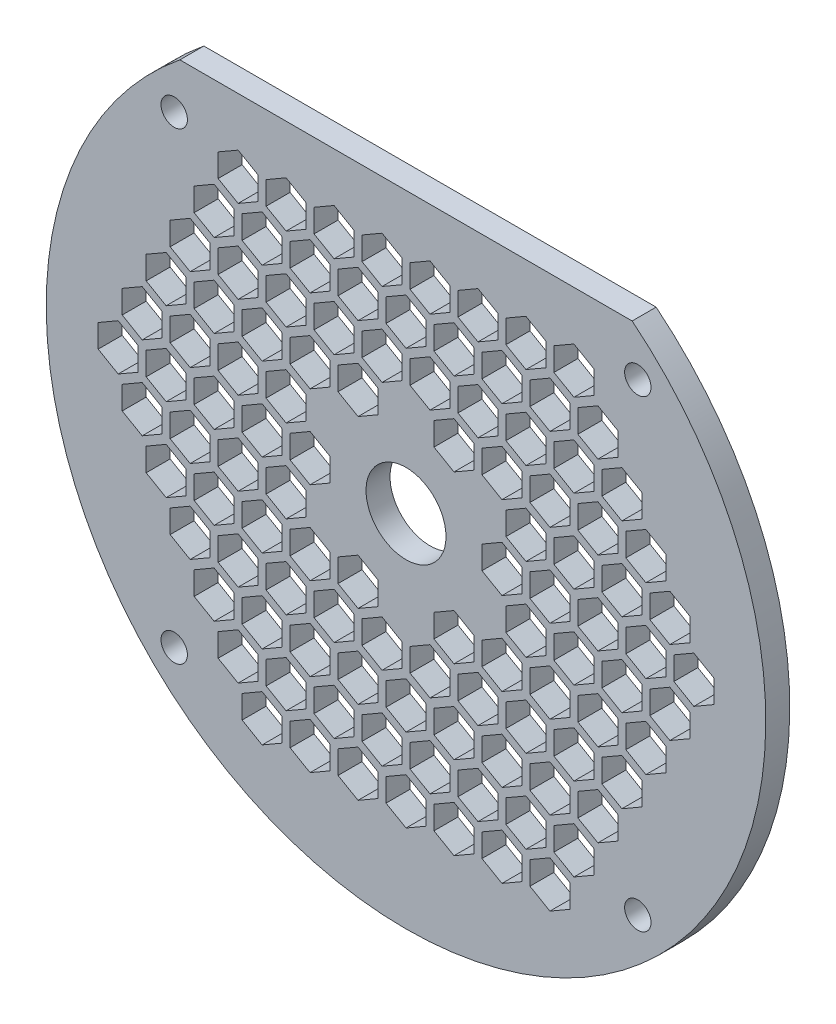
from build123d import *

# Parameters (mm, degrees)
SKETCH_1_R          = 90
EXTRUDE_1_DEPTH     = 6
SKETCH_3_R          = 10
CUT_EXTRUDE_2_DEPTH = 128.42056349
SKETCH_4_R          = 3.3
CUT_EXTRUDE_3_DEPTH = 128.42056349
SKETCH_5_W          = 220
SKETCH_5_H          = 40
CUT_EXTRUDE_4_DEPTH = 128.42056349
CUT_EXTRUDE_5_DEPTH = 128.42056349
CUT_EXTRUDE_7_DEPTH = 128.42056349
CUT_EXTRUDE_8_DEPTH = 128.42056349
CUT_EXTRUDE_9_DEPTH = 128.42056349


with BuildPart() as part:
    # 草图1 → 凸台-拉伸1 (new body)
    with BuildSketch(Plane.XY):
        Circle(SKETCH_1_R)
    extrude(amount=EXTRUDE_1_DEPTH)

    # 草图3 → 切除-拉伸2 (cut, through all)
    with BuildSketch(Plane.XY):
        Circle(SKETCH_3_R)
    extrude(amount=CUT_EXTRUDE_2_DEPTH, mode=Mode.SUBTRACT)

    # 草图4 → 切除-拉伸3 (cut, through all)
    with BuildSketch(Plane.XY):
        with Locations((57.982756, 57.982756)):
            Circle(SKETCH_4_R)
        with Locations((-57.982756, 57.982756)):
            Circle(SKETCH_4_R)
        with Locations((-57.982756, -57.982756)):
            Circle(SKETCH_4_R)
        with Locations((57.982756, -57.982756)):
            Circle(SKETCH_4_R)
    extrude(amount=CUT_EXTRUDE_3_DEPTH, mode=Mode.SUBTRACT)

    # 草图5 → 切除-拉伸4 (cut, through all)
    with BuildSketch(Plane.XY):
        with Locations((0, 90)):
            Rectangle(SKETCH_5_W, SKETCH_5_H)
    extrude(amount=CUT_EXTRUDE_4_DEPTH, mode=Mode.SUBTRACT)

    # 草图6 → 切除-拉伸5 (cut, through all)
    with BuildSketch(Plane.XY):
        Polygon((0, -56.5785), (5, -59.4653), (5, -65.2388), (0, -68.1255), (-5, -65.2388), (-5, -59.4653), align=None)
        Polygon((12, -56.5785), (17, -59.4653), (17, -65.2388), (12, -68.1255), (7, -65.2388), (7, -59.4653), align=None)
        Polygon((-12, -56.5785), (-7, -59.4653), (-7, -65.2388), (-12, -68.1255), (-17, -65.2388), (-17, -59.4653), align=None)
        Polygon((24, -56.5785), (29, -59.4653), (29, -65.2388), (24, -68.1255), (19, -65.2388), (19, -59.4653), align=None)
        Polygon((-24, -56.5785), (-19, -59.4653), (-19, -65.2388), (-24, -68.1255), (-29, -65.2388), (-29, -59.4653), align=None)
        Polygon((36, -56.5785), (41, -59.4653), (41, -65.2388), (36, -68.1255), (31, -65.2388), (31, -59.4653), align=None)
        Polygon((-36, -56.5785), (-31, -59.4653), (-31, -65.2388), (-36, -68.1255), (-41, -65.2388), (-41, -59.4653), align=None)
        Polygon((6, -46.1865), (11, -49.0733), (11, -54.8468), (6, -57.7335), (1, -54.8468), (1, -49.0733), align=None)
        Polygon((-6, -46.1865), (-1, -49.0733), (-1, -54.8468), (-6, -57.7335), (-11, -54.8468), (-11, -49.0733), align=None)
        Polygon((18, -46.1865), (23, -49.0733), (23, -54.8468), (18, -57.7335), (13, -54.8468), (13, -49.0733), align=None)
        Polygon((-18, -46.1865), (-13, -49.0733), (-13, -54.8468), (-18, -57.7335), (-23, -54.8468), (-23, -49.0733), align=None)
        Polygon((30, -46.1865), (35, -49.0733), (35, -54.8468), (30, -57.7335), (25, -54.8468), (25, -49.0733), align=None)
        Polygon((-30, -46.1865), (-25, -49.0733), (-25, -54.8468), (-30, -57.7335), (-35, -54.8468), (-35, -49.0733), align=None)
        Polygon((42, -46.1865), (47, -49.0733), (47, -54.8468), (42, -57.7335), (37, -54.8468), (37, -49.0733), align=None)
        Polygon((-42, -46.1865), (-37, -49.0733), (-37, -54.8468), (-42, -57.7335), (-47, -54.8468), (-47, -49.0733), align=None)
        Polygon((0, -35.7945), (5, -38.6813), (5, -44.4548), (0, -47.3415), (-5, -44.4548), (-5, -38.6813), align=None)
        Polygon((12, -35.7945), (17, -38.6813), (17, -44.4548), (12, -47.3415), (7, -44.4548), (7, -38.6813), align=None)
        Polygon((-12, -35.7945), (-7, -38.6813), (-7, -44.4548), (-12, -47.3415), (-17, -44.4548), (-17, -38.6813), align=None)
        Polygon((24, -35.7945), (29, -38.6813), (29, -44.4548), (24, -47.3415), (19, -44.4548), (19, -38.6813), align=None)
        Polygon((-24, -35.7945), (-19, -38.6813), (-19, -44.4548), (-24, -47.3415), (-29, -44.4548), (-29, -38.6813), align=None)
        Polygon((36, -35.7945), (41, -38.6813), (41, -44.4548), (36, -47.3415), (31, -44.4548), (31, -38.6813), align=None)
        Polygon((-36, -35.7945), (-31, -38.6813), (-31, -44.4548), (-36, -47.3415), (-41, -44.4548), (-41, -38.6813), align=None)
        Polygon((48, -35.7945), (53, -38.6813), (53, -44.4548), (48, -47.3415), (43, -44.4548), (43, -38.6813), align=None)
        Polygon((-48, -35.7945), (-43, -38.6813), (-43, -44.4548), (-48, -47.3415), (-53, -44.4548), (-53, -38.6813), align=None)
    extrude(amount=CUT_EXTRUDE_5_DEPTH, mode=Mode.SUBTRACT)

    # 草图8 → 切除-拉伸7 (cut, through all)
    with BuildSketch(Plane.XY):
        Polygon((6, -25.4025), (11, -28.2893), (11, -34.0628), (6, -36.9495), (1, -34.0628), (1, -28.2893), align=None)
        Polygon((-6, -25.4025), (-1, -28.2893), (-1, -34.0628), (-6, -36.9495), (-11, -34.0628), (-11, -28.2893), align=None)
        Polygon((18, -25.4025), (23, -28.2893), (23, -34.0628), (18, -36.9495), (13, -34.0628), (13, -28.2893), align=None)
        Polygon((-18, -25.4025), (-13, -28.2893), (-13, -34.0628), (-18, -36.9495), (-23, -34.0628), (-23, -28.2893), align=None)
        Polygon((30, -25.4025), (35, -28.2893), (35, -34.0628), (30, -36.9495), (25, -34.0628), (25, -28.2893), align=None)
        Polygon((-30, -25.4025), (-25, -28.2893), (-25, -34.0628), (-30, -36.9495), (-35, -34.0628), (-35, -28.2893), align=None)
        Polygon((42, -25.4025), (47, -28.2893), (47, -34.0628), (42, -36.9495), (37, -34.0628), (37, -28.2893), align=None)
        Polygon((-42, -25.4025), (-37, -28.2893), (-37, -34.0628), (-42, -36.9495), (-47, -34.0628), (-47, -28.2893), align=None)
        Polygon((54, -25.4025), (59, -28.2893), (59, -34.0628), (54, -36.9495), (49, -34.0628), (49, -28.2893), align=None)
        Polygon((-54, -25.4025), (-49, -28.2893), (-49, -34.0628), (-54, -36.9495), (-59, -34.0628), (-59, -28.2893), align=None)
        Polygon((12, -15.0105), (17, -17.8973), (17, -23.6708), (12, -26.5575), (7, -23.6708), (7, -17.8973), align=None)
        Polygon((-12, -15.0105), (-7, -17.8973), (-7, -23.6708), (-12, -26.5575), (-17, -23.6708), (-17, -17.8973), align=None)
        Polygon((24, -15.0105), (29, -17.8973), (29, -23.6708), (24, -26.5575), (19, -23.6708), (19, -17.8973), align=None)
        Polygon((-24, -15.0105), (-19, -17.8973), (-19, -23.6708), (-24, -26.5575), (-29, -23.6708), (-29, -17.8973), align=None)
        Polygon((36, -15.0105), (41, -17.8973), (41, -23.6708), (36, -26.5575), (31, -23.6708), (31, -17.8973), align=None)
        Polygon((-36, -15.0105), (-31, -17.8973), (-31, -23.6708), (-36, -26.5575), (-41, -23.6708), (-41, -17.8973), align=None)
        Polygon((48, -15.0105), (53, -17.8973), (53, -23.6708), (48, -26.5575), (43, -23.6708), (43, -17.8973), align=None)
        Polygon((-48, -15.0105), (-43, -17.8973), (-43, -23.6708), (-48, -26.5575), (-53, -23.6708), (-53, -17.8973), align=None)
        Polygon((60, -15.0105), (65, -17.8973), (65, -23.6708), (60, -26.5575), (55, -23.6708), (55, -17.8973), align=None)
        Polygon((-60, -15.0105), (-55, -17.8973), (-55, -23.6708), (-60, -26.5575), (-65, -23.6708), (-65, -17.8973), align=None)
        Polygon((30, -4.6185), (35, -7.5053), (35, -13.2788), (30, -16.1655), (25, -13.2788), (25, -7.5053), align=None)
        Polygon((-30, -4.6185), (-25, -7.5053), (-25, -13.2788), (-30, -16.1655), (-35, -13.2788), (-35, -7.5053), align=None)
        Polygon((42, -4.6185), (47, -7.5053), (47, -13.2788), (42, -16.1655), (37, -13.2788), (37, -7.5053), align=None)
        Polygon((-42, -4.6185), (-37, -7.5053), (-37, -13.2788), (-42, -16.1655), (-47, -13.2788), (-47, -7.5053), align=None)
        Polygon((54, -4.6185), (59, -7.5053), (59, -13.2788), (54, -16.1655), (49, -13.2788), (49, -7.5053), align=None)
        Polygon((-54, -4.6185), (-49, -7.5053), (-49, -13.2788), (-54, -16.1655), (-59, -13.2788), (-59, -7.5053), align=None)
        Polygon((66, -4.6185), (71, -7.5053), (71, -13.2788), (66, -16.1655), (61, -13.2788), (61, -7.5053), align=None)
        Polygon((-66, -4.6185), (-61, -7.5053), (-61, -13.2788), (-66, -16.1655), (-71, -13.2788), (-71, -7.5053), align=None)
    extrude(amount=CUT_EXTRUDE_7_DEPTH, mode=Mode.SUBTRACT)

    # 草图9 → 切除-拉伸8 (cut, through all)
    with BuildSketch(Plane.XY):
        Polygon((24, 5.7735), (29, 2.8868), (29, -2.8868), (24, -5.7735), (19, -2.8868), (19, 2.8868), align=None)
        Polygon((-24, 5.7735), (-19, 2.8868), (-19, -2.8868), (-24, -5.7735), (-29, -2.8868), (-29, 2.8868), align=None)
        Polygon((36, 5.7735), (41, 2.8868), (41, -2.8868), (36, -5.7735), (31, -2.8868), (31, 2.8868), align=None)
        Polygon((-36, 5.7735), (-31, 2.8868), (-31, -2.8868), (-36, -5.7735), (-41, -2.8868), (-41, 2.8868), align=None)
        Polygon((48, 5.7735), (53, 2.8868), (53, -2.8868), (48, -5.7735), (43, -2.8868), (43, 2.8868), align=None)
        Polygon((-48, 5.7735), (-43, 2.8868), (-43, -2.8868), (-48, -5.7735), (-53, -2.8868), (-53, 2.8868), align=None)
        Polygon((60, 5.7735), (65, 2.8868), (65, -2.8868), (60, -5.7735), (55, -2.8868), (55, 2.8868), align=None)
        Polygon((-60, 5.7735), (-55, 2.8868), (-55, -2.8868), (-60, -5.7735), (-65, -2.8868), (-65, 2.8868), align=None)
        Polygon((72, 5.7735), (77, 2.8868), (77, -2.8868), (72, -5.7735), (67, -2.8868), (67, 2.8868), align=None)
        Polygon((-72, 5.7735), (-67, 2.8868), (-67, -2.8868), (-72, -5.7735), (-77, -2.8868), (-77, 2.8868), align=None)
        Polygon((30, 16.1655), (35, 13.2788), (35, 7.5053), (30, 4.6185), (25, 7.5053), (25, 13.2788), align=None)
        Polygon((-30, 16.1655), (-25, 13.2788), (-25, 7.5053), (-30, 4.6185), (-35, 7.5053), (-35, 13.2788), align=None)
        Polygon((42, 16.1655), (47, 13.2788), (47, 7.5053), (42, 4.6185), (37, 7.5053), (37, 13.2788), align=None)
        Polygon((-42, 16.1655), (-37, 13.2788), (-37, 7.5053), (-42, 4.6185), (-47, 7.5053), (-47, 13.2788), align=None)
        Polygon((54, 16.1655), (59, 13.2788), (59, 7.5053), (54, 4.6185), (49, 7.5053), (49, 13.2788), align=None)
        Polygon((-54, 16.1655), (-49, 13.2788), (-49, 7.5053), (-54, 4.6185), (-59, 7.5053), (-59, 13.2788), align=None)
        Polygon((66, 16.1655), (71, 13.2788), (71, 7.5053), (66, 4.6185), (61, 7.5053), (61, 13.2788), align=None)
        Polygon((-66, 16.1655), (-61, 13.2788), (-61, 7.5053), (-66, 4.6185), (-71, 7.5053), (-71, 13.2788), align=None)
        Polygon((12, 26.5575), (17, 23.6708), (17, 17.8973), (12, 15.0105), (7, 17.8973), (7, 23.6708), align=None)
        Polygon((-12, 26.5575), (-7, 23.6708), (-7, 17.8973), (-12, 15.0105), (-17, 17.8973), (-17, 23.6708), align=None)
        Polygon((24, 26.5575), (29, 23.6708), (29, 17.8973), (24, 15.0105), (19, 17.8973), (19, 23.6708), align=None)
        Polygon((-24, 26.5575), (-19, 23.6708), (-19, 17.8973), (-24, 15.0105), (-29, 17.8973), (-29, 23.6708), align=None)
        Polygon((36, 26.5575), (41, 23.6708), (41, 17.8973), (36, 15.0105), (31, 17.8973), (31, 23.6708), align=None)
        Polygon((-36, 26.5575), (-31, 23.6708), (-31, 17.8973), (-36, 15.0105), (-41, 17.8973), (-41, 23.6708), align=None)
        Polygon((48, 26.5575), (53, 23.6708), (53, 17.8973), (48, 15.0105), (43, 17.8973), (43, 23.6708), align=None)
        Polygon((-48, 26.5575), (-43, 23.6708), (-43, 17.8973), (-48, 15.0105), (-53, 17.8973), (-53, 23.6708), align=None)
        Polygon((60, 26.5575), (65, 23.6708), (65, 17.8973), (60, 15.0105), (55, 17.8973), (55, 23.6708), align=None)
        Polygon((-60, 26.5575), (-55, 23.6708), (-55, 17.8973), (-60, 15.0105), (-65, 17.8973), (-65, 23.6708), align=None)
    extrude(amount=CUT_EXTRUDE_8_DEPTH, mode=Mode.SUBTRACT)

    # 草图10 → 切除-拉伸9 (cut, through all)
    with BuildSketch(Plane.XY):
        Polygon((6, 36.9495), (11, 34.0628), (11, 28.2893), (6, 25.4025), (1, 28.2893), (1, 34.0628), align=None)
        Polygon((-6, 36.9495), (-1, 34.0628), (-1, 28.2893), (-6, 25.4025), (-11, 28.2893), (-11, 34.0628), align=None)
        Polygon((18, 36.9495), (23, 34.0628), (23, 28.2893), (18, 25.4025), (13, 28.2893), (13, 34.0628), align=None)
        Polygon((-18, 36.9495), (-13, 34.0628), (-13, 28.2893), (-18, 25.4025), (-23, 28.2893), (-23, 34.0628), align=None)
        Polygon((30, 36.9495), (35, 34.0628), (35, 28.2893), (30, 25.4025), (25, 28.2893), (25, 34.0628), align=None)
        Polygon((-30, 36.9495), (-25, 34.0628), (-25, 28.2893), (-30, 25.4025), (-35, 28.2893), (-35, 34.0628), align=None)
        Polygon((42, 36.9495), (47, 34.0628), (47, 28.2893), (42, 25.4025), (37, 28.2893), (37, 34.0628), align=None)
        Polygon((-42, 36.9495), (-37, 34.0628), (-37, 28.2893), (-42, 25.4025), (-47, 28.2893), (-47, 34.0628), align=None)
        Polygon((54, 36.9495), (59, 34.0628), (59, 28.2893), (54, 25.4025), (49, 28.2893), (49, 34.0628), align=None)
        Polygon((-54, 36.9495), (-49, 34.0628), (-49, 28.2893), (-54, 25.4025), (-59, 28.2893), (-59, 34.0628), align=None)
        Polygon((0, 47.3415), (5, 44.4548), (5, 38.6813), (0, 35.7945), (-5, 38.6813), (-5, 44.4548), align=None)
        Polygon((12, 47.3415), (17, 44.4548), (17, 38.6813), (12, 35.7945), (7, 38.6813), (7, 44.4548), align=None)
        Polygon((-12, 47.3415), (-7, 44.4548), (-7, 38.6813), (-12, 35.7945), (-17, 38.6813), (-17, 44.4548), align=None)
        Polygon((24, 47.3415), (29, 44.4548), (29, 38.6813), (24, 35.7945), (19, 38.6813), (19, 44.4548), align=None)
        Polygon((-24, 47.3415), (-19, 44.4548), (-19, 38.6813), (-24, 35.7945), (-29, 38.6813), (-29, 44.4548), align=None)
        Polygon((36, 47.3415), (41, 44.4548), (41, 38.6813), (36, 35.7945), (31, 38.6813), (31, 44.4548), align=None)
        Polygon((-36, 47.3415), (-31, 44.4548), (-31, 38.6813), (-36, 35.7945), (-41, 38.6813), (-41, 44.4548), align=None)
        Polygon((48, 47.3415), (53, 44.4548), (53, 38.6813), (48, 35.7945), (43, 38.6813), (43, 44.4548), align=None)
        Polygon((-48, 47.3415), (-43, 44.4548), (-43, 38.6813), (-48, 35.7945), (-53, 38.6813), (-53, 44.4548), align=None)
        Polygon((6, 57.7335), (11, 54.8468), (11, 49.0733), (6, 46.1865), (1, 49.0733), (1, 54.8468), align=None)
        Polygon((-6, 57.7335), (-1, 54.8468), (-1, 49.0733), (-6, 46.1865), (-11, 49.0733), (-11, 54.8468), align=None)
        Polygon((18, 57.7335), (23, 54.8468), (23, 49.0733), (18, 46.1865), (13, 49.0733), (13, 54.8468), align=None)
        Polygon((-18, 57.7335), (-13, 54.8468), (-13, 49.0733), (-18, 46.1865), (-23, 49.0733), (-23, 54.8468), align=None)
        Polygon((30, 57.7335), (35, 54.8468), (35, 49.0733), (30, 46.1865), (25, 49.0733), (25, 54.8468), align=None)
        Polygon((-30, 57.7335), (-25, 54.8468), (-25, 49.0733), (-30, 46.1865), (-35, 49.0733), (-35, 54.8468), align=None)
        Polygon((42, 57.7335), (47, 54.8468), (47, 49.0733), (42, 46.1865), (37, 49.0733), (37, 54.8468), align=None)
        Polygon((-42, 57.7335), (-37, 54.8468), (-37, 49.0733), (-42, 46.1865), (-47, 49.0733), (-47, 54.8468), align=None)
    extrude(amount=CUT_EXTRUDE_9_DEPTH, mode=Mode.SUBTRACT)


solid = part.part
